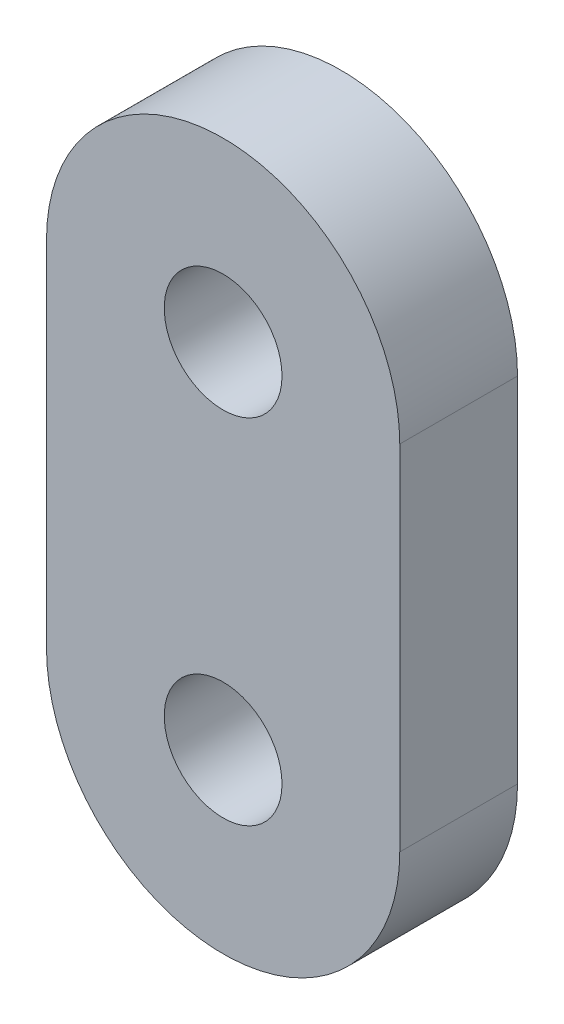
from build123d import *

# Parameters (mm, degrees)
MODEL_R                 = 1.5
SALIENTE_EXTRUIR1_DEPTH = 3


with BuildPart() as part:
    # Model → Saliente-Extruir1 (new body)
    with BuildSketch(Plane.XY):
        with BuildLine():
            Line((213.25077615, 152.428489513), (213.25077615, 161.428489513))
            ThreePointArc((213.25077615, 161.428489513), (208.75077615, 165.928489513), (204.25077615, 161.428489513))
            Line((204.25077615, 161.428489513), (204.25077615, 152.428489513))
            ThreePointArc((204.25077615, 152.428489513), (208.75077615, 147.928489513), (213.25077615, 152.428489513))
        make_face()
        with Locations((208.75077615, 152.428489513)):
            Circle(MODEL_R, mode=Mode.SUBTRACT)
        with Locations((208.75077615, 161.428489513)):
            Circle(MODEL_R, mode=Mode.SUBTRACT)
    extrude(amount=SALIENTE_EXTRUIR1_DEPTH)


solid = part.part
